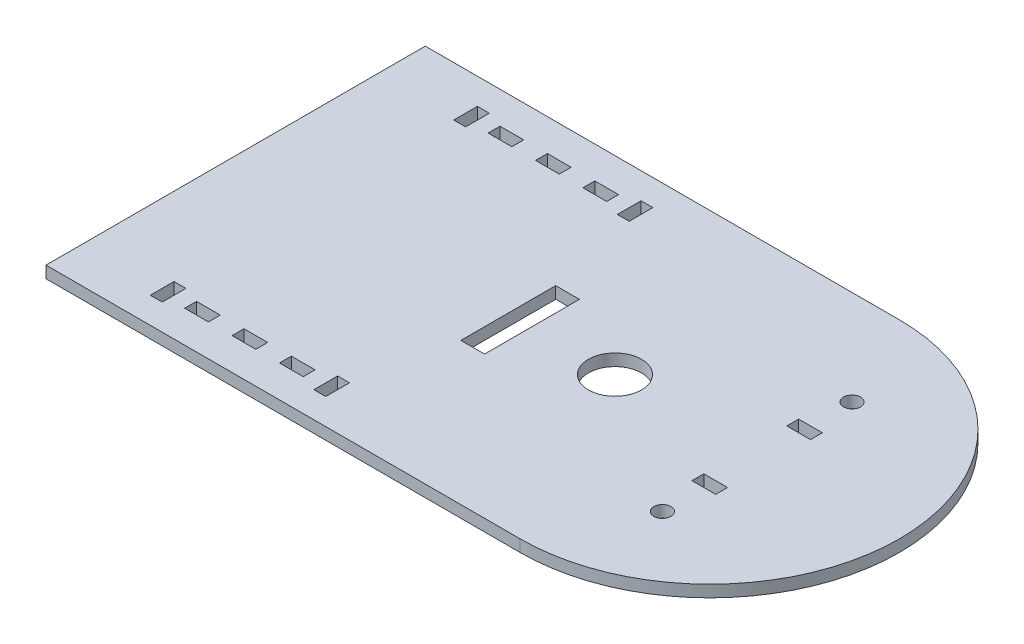
from build123d import *

# Parameters (mm, degrees)
BOSS_EXTRUDE1_DEPTH = 3.175
CUT_EXTRUDE2_REACH  = 186.942
SKETCH3_W           = 3.175
SKETCH3_H           = 6.35
CUT_EXTRUDE3_REACH  = 186.942
SKETCH4_R           = 2.286
SKETCH5_W           = 6.35
SKETCH5_H           = 3.175
CUT_EXTRUDE4_DEPTH  = 3.175
SKETCH6_W           = 6.35
SKETCH6_H           = 3.175
CUT_EXTRUDE5_DEPTH  = 3.175
SKETCH7_R           = 7.112
SKETCH7_W           = 6.35
SKETCH7_H           = 25.4
CUT_EXTRUDE6_DEPTH  = 3.175


with BuildPart() as part:
    # Sketch1 → Boss-Extrude1 (new body)
    with BuildSketch(Plane(origin=(0, 0, 0), x_dir=(1, 0, 0), z_dir=(0, 1, 0))):
        with BuildLine():
            Line((0, -50.8), (0, 50.8))
            Line((0, 50.8), (127, 50.8))
            ThreePointArc((127, 50.8), (177.8, 0), (127, -50.8))
            Line((127, -50.8), (0, -50.8))
        make_face()
    extrude(amount=BOSS_EXTRUDE1_DEPTH)

    # Sketch3 → Cut-Extrude2 (cut, up to next)
    with BuildSketch(Plane(origin=(0, 3.175, 0), x_dir=(1, 0, 0), z_dir=(0, 1, 0)), mode=Mode.PRIVATE) as cut_extrude2_sk1:
        with Locations((22.5425, 40.64)):
            Rectangle(SKETCH3_W, SKETCH3_H)
    cut_extrude2_tool1 = extrude(cut_extrude2_sk1.sketch, amount=-CUT_EXTRUDE2_REACH, mode=Mode.PRIVATE) & part.part
    # Sketch3 → Cut-Extrude2 (cut, up to next)
    with BuildSketch(Plane(origin=(0, 3.175, 0), x_dir=(1, 0, 0), z_dir=(0, 1, 0)), mode=Mode.PRIVATE) as cut_extrude2_sk2:
        with Locations((66.3575, 40.64)):
            Rectangle(SKETCH3_W, SKETCH3_H)
    cut_extrude2_tool2 = extrude(cut_extrude2_sk2.sketch, amount=-CUT_EXTRUDE2_REACH, mode=Mode.PRIVATE) & part.part
    # Sketch3 → Cut-Extrude2 (cut, up to next)
    with BuildSketch(Plane(origin=(0, 3.175, 0), x_dir=(1, 0, 0), z_dir=(0, 1, 0)), mode=Mode.PRIVATE) as cut_extrude2_sk3:
        with Locations((66.3575, -40.64)):
            Rectangle(SKETCH3_W, SKETCH3_H)
    cut_extrude2_tool3 = extrude(cut_extrude2_sk3.sketch, amount=-CUT_EXTRUDE2_REACH, mode=Mode.PRIVATE) & part.part
    # Sketch3 → Cut-Extrude2 (cut, up to next)
    with BuildSketch(Plane(origin=(0, 3.175, 0), x_dir=(1, 0, 0), z_dir=(0, 1, 0)), mode=Mode.PRIVATE) as cut_extrude2_sk4:
        with Locations((22.5425, -40.64)):
            Rectangle(SKETCH3_W, SKETCH3_H)
    cut_extrude2_tool4 = extrude(cut_extrude2_sk4.sketch, amount=-CUT_EXTRUDE2_REACH, mode=Mode.PRIVATE) & part.part
    add(cut_extrude2_tool1.solids().sort_by_distance((22.5425, 3.175, -40.64))[0], mode=Mode.SUBTRACT)
    add(cut_extrude2_tool2.solids().sort_by_distance((66.3575, 3.175, -40.64))[0], mode=Mode.SUBTRACT)
    add(cut_extrude2_tool3.solids().sort_by_distance((66.3575, 3.175, 40.64))[0], mode=Mode.SUBTRACT)
    add(cut_extrude2_tool4.solids().sort_by_distance((22.5425, 3.175, 40.64))[0], mode=Mode.SUBTRACT)

    # Sketch4 → Cut-Extrude3 (cut, up to next)
    with BuildSketch(Plane(origin=(0, 3.175, 0), x_dir=(1, 0, 0), z_dir=(0, 1, 0)), mode=Mode.PRIVATE) as cut_extrude3_sk1:
        with Locations(Location((139.7, 25.4, 0), (0, 0, 270))):
            Circle(SKETCH4_R)
    cut_extrude3_tool1 = extrude(cut_extrude3_sk1.sketch, amount=-CUT_EXTRUDE3_REACH, mode=Mode.PRIVATE) & part.part
    # Sketch4 → Cut-Extrude3 (cut, up to next)
    with BuildSketch(Plane(origin=(0, 3.175, 0), x_dir=(1, 0, 0), z_dir=(0, 1, 0)), mode=Mode.PRIVATE) as cut_extrude3_sk2:
        with Locations(Location((139.7, -25.4, 0), (0, 0, 90))):
            Circle(SKETCH4_R)
    cut_extrude3_tool2 = extrude(cut_extrude3_sk2.sketch, amount=-CUT_EXTRUDE3_REACH, mode=Mode.PRIVATE) & part.part
    add(cut_extrude3_tool1.solids().sort_by_distance((139.7, 3.175, -25.4))[0], mode=Mode.SUBTRACT)
    add(cut_extrude3_tool2.solids().sort_by_distance((139.7, 3.175, 25.4))[0], mode=Mode.SUBTRACT)

    # Sketch5 → Cut-Extrude4 (cut)
    with BuildSketch(Plane(origin=(0, 3.175, 0), x_dir=(1, 0, 0), z_dir=(0, 1, 0))):
        with Locations((139.7, -12.7)):
            Rectangle(SKETCH5_W, SKETCH5_H)
        with Locations((139.7, 12.7)):
            Rectangle(SKETCH5_W, SKETCH5_H)
    extrude(amount=-CUT_EXTRUDE4_DEPTH, mode=Mode.SUBTRACT)

    # Sketch6 → Cut-Extrude5 (cut)
    with BuildSketch(Plane(origin=(0, 3.175, 0), x_dir=(1, 0, 0), z_dir=(0, 1, 0))):
        with Locations((44.45, 40.64)):
            Rectangle(SKETCH6_W, SKETCH6_H)
        with Locations((44.45, -40.64)):
            Rectangle(SKETCH6_W, SKETCH6_H)
        with Locations((57.15, 40.64)):
            Rectangle(SKETCH6_W, SKETCH6_H)
        with Locations((31.75, 40.64)):
            Rectangle(SKETCH6_W, SKETCH6_H)
        with Locations((31.75, -40.64)):
            Rectangle(SKETCH6_W, SKETCH6_H)
        with Locations((57.15, -40.64)):
            Rectangle(SKETCH6_W, SKETCH6_H)
    extrude(amount=-CUT_EXTRUDE5_DEPTH, mode=Mode.SUBTRACT)

    # Sketch7 → Cut-Extrude6 (cut)
    with BuildSketch(Plane(origin=(0, 3.175, 0), x_dir=(1, 0, 0), z_dir=(0, 1, 0))):
        with Locations(Location((101.6, 0, 0), (0, 0, 270))):
            Circle(SKETCH7_R)
        with Locations((76.2, 0)):
            Rectangle(SKETCH7_W, SKETCH7_H)
    extrude(amount=-CUT_EXTRUDE6_DEPTH, mode=Mode.SUBTRACT)


solid = part.part
